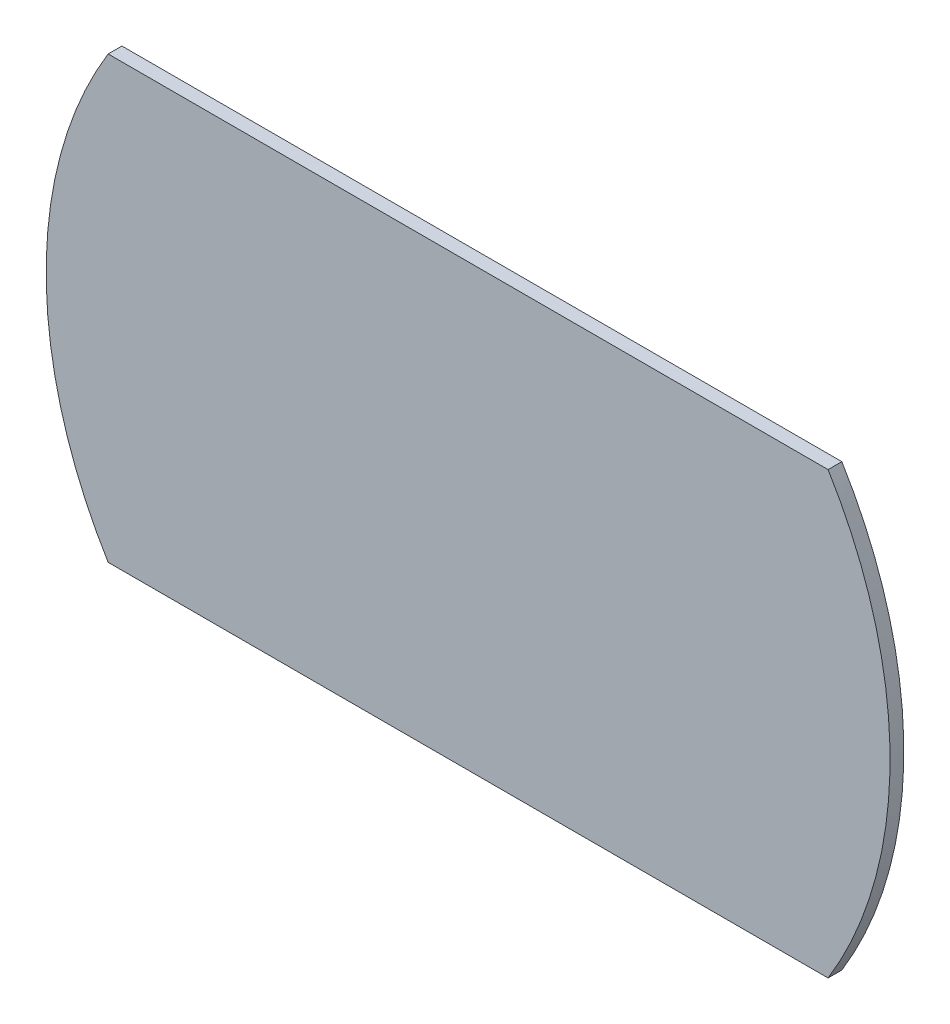
from build123d import *

# Parameters (mm, degrees)
BOSS_EXTRUDE1_DEPTH = 19.05


with BuildPart() as part:
    # Sketch1 → Boss-Extrude1 (new body)
    with BuildSketch(Plane.XY):
        with BuildLine():
            Line((-498.383988507, 304.8), (498.383988507, 304.8))
            ThreePointArc((498.383988507, 304.8), (584.2, 0), (498.383988507, -304.8))
            Line((498.383988507, -304.8), (-498.383988507, -304.8))
            ThreePointArc((-498.383988507, -304.8), (-584.2, 0), (-498.383988507, 304.8))
        make_face()
    extrude(amount=BOSS_EXTRUDE1_DEPTH)


solid = part.part
